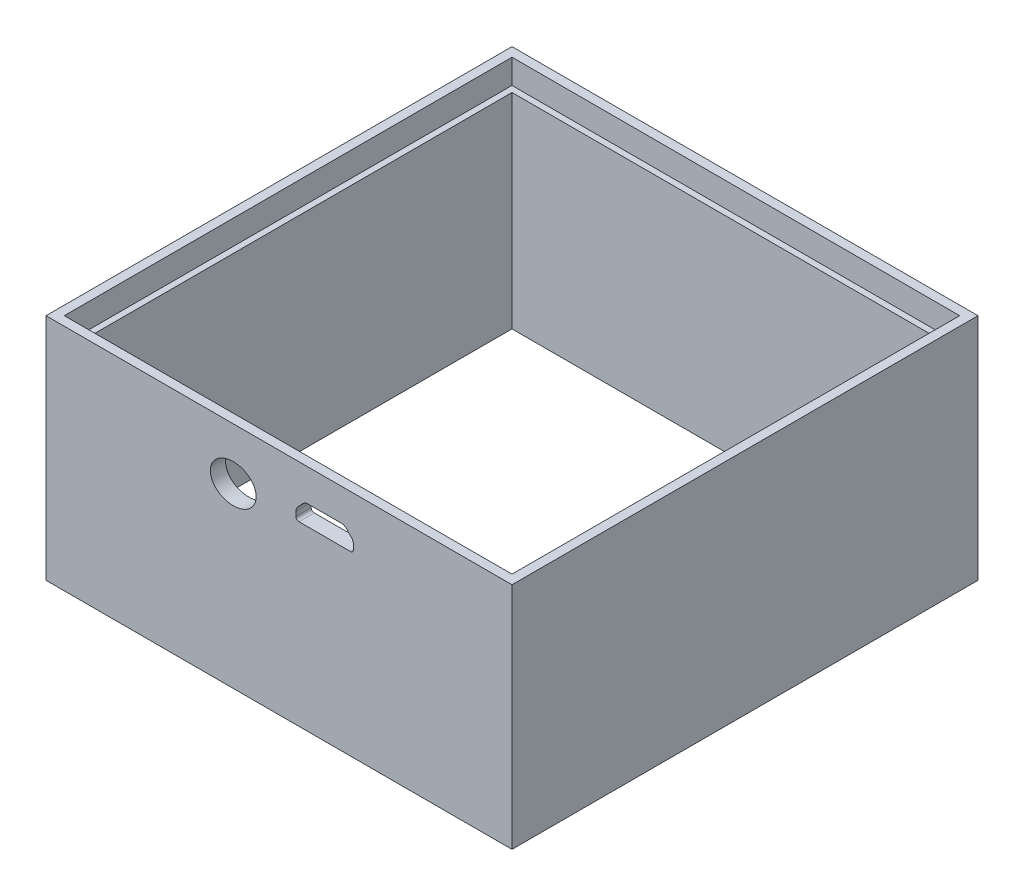
from build123d import *

# Parameters (mm, degrees)
SKETCH1_W           = 61
SKETCH1_H           = 61
SKETCH1_W_2         = 57
SKETCH1_H_2         = 57
BOSS_EXTRUDE2_DEPTH = 30
SKETCH2_W           = 58.6
SKETCH2_H           = 58.6
CUT_EXTRUDE1_DEPTH  = 3.2
SKETCH4_RX          = 3
SKETCH4_RY          = 2.5
CUT_EXTRUDE2_DEPTH  = 73.878323252


with BuildPart() as part:
    # Sketch1 → Boss-Extrude2 (new body)
    with BuildSketch(Plane(origin=(0, 0, 0), x_dir=(1, 0, 0), z_dir=(0, 1, 0))):
        with Locations((0, 28.5)):
            Rectangle(SKETCH1_W, SKETCH1_H)
        with Locations((0, 28.5)):
            Rectangle(SKETCH1_W_2, SKETCH1_H_2, mode=Mode.SUBTRACT)
    extrude(amount=BOSS_EXTRUDE2_DEPTH)

    # Sketch2 → Cut-Extrude1 (cut)
    with BuildSketch(Plane(origin=(0, 30, 0), x_dir=(1, 0, 0), z_dir=(0, 1, 0))):
        with Locations((0, 28.5)):
            Rectangle(SKETCH2_W, SKETCH2_H)
    extrude(amount=-CUT_EXTRUDE1_DEPTH, mode=Mode.SUBTRACT)

    # Sketch4 → Cut-Extrude2 (cut, through all)
    with BuildSketch(Plane(origin=(0, 0, 0), x_dir=(-1, 0, 0), z_dir=(0, 0, -1))):
        with BuildLine():
            Line((-5.98277454, 23.2), (-5.98277454, 25.8))
            Line((-5.98277454, 25.8), (-8.131556664, 25.8))
            ThreePointArc((-8.131556664, 25.8), (-8.523646049, 25.719927124), (-8.852943985, 25.492531828))
            Line((-8.852943985, 25.492531828), (-9.479161861, 24.840221541))
            ThreePointArc((-9.479161861, 24.840221541), (-9.685510311, 24.520927357), (-9.75777454, 24.147689712))
            Line((-9.75777454, 24.147689712), (-9.75777454, 23.6))
            ThreePointArc((-9.75777454, 23.6), (-9.640617252, 23.317157288), (-9.35777454, 23.2))
            Line((-9.35777454, 23.2), (-5.98277454, 23.2))
        make_face()
        with BuildLine():
            Line((-3.833992416, 25.8), (-5.98277454, 25.8))
            Line((-5.98277454, 25.8), (-5.98277454, 23.2))
            Line((-5.98277454, 23.2), (-2.60777454, 23.2))
            ThreePointArc((-2.60777454, 23.2), (-2.324931828, 23.317157288), (-2.20777454, 23.6))
            Line((-2.20777454, 23.6), (-2.20777454, 24.147689712))
            ThreePointArc((-2.20777454, 24.147689712), (-2.280038769, 24.520927357), (-2.486387219, 24.840221541))
            Line((-2.486387219, 24.840221541), (-3.112605095, 25.492531828))
            ThreePointArc((-3.112605095, 25.492531828), (-3.441903031, 25.719927124), (-3.833992416, 25.8))
        make_face()
        with Locations(Location((5.992555786, 23.215339324), (0, 0, 180))):
            Ellipse(SKETCH4_RX, SKETCH4_RY)
    extrude(amount=-CUT_EXTRUDE2_DEPTH, mode=Mode.SUBTRACT)


solid = part.part
